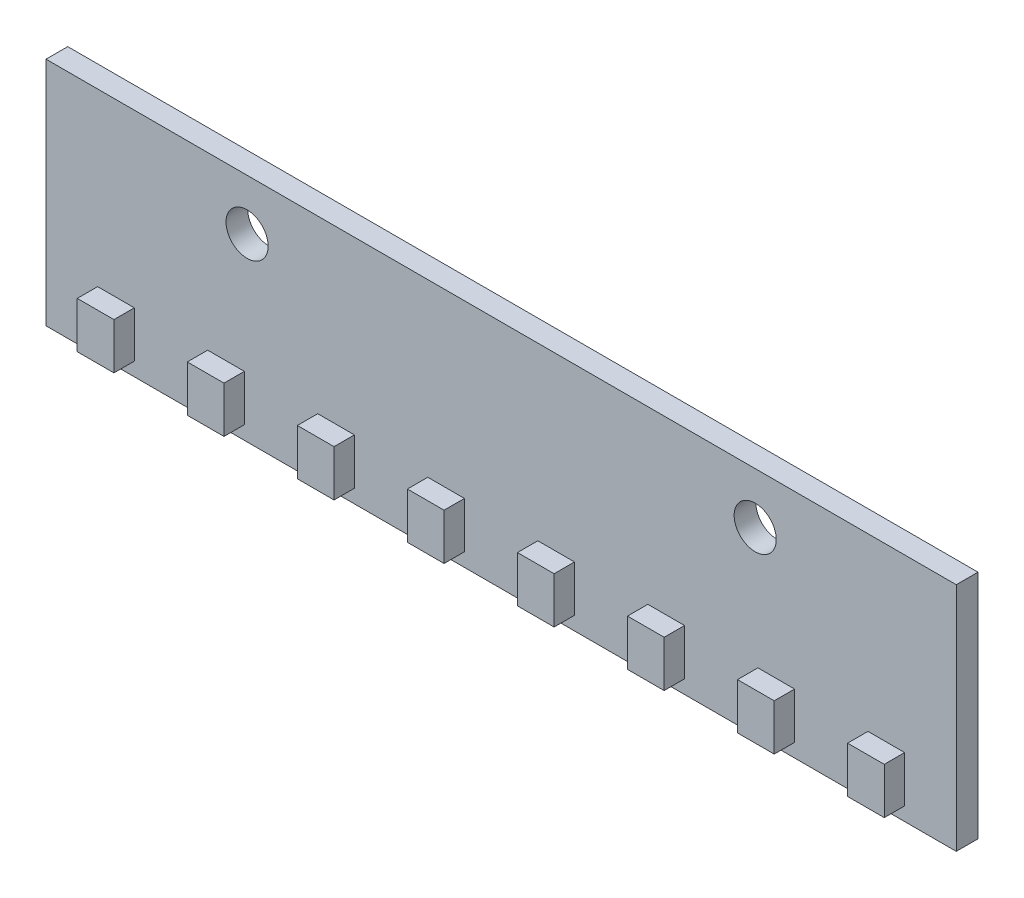
from build123d import *

# Parameters (mm, degrees)
ESBO_O1_W                = 67
ESBO_O1_H                = 17
RESSALTO_EXTRUS_O1_DEPTH = 1.6
ESBO_O2_R                = 1.55
CORTE_EXTRUS_O1_DEPTH    = 70.141593849
ESBO_O3_W                = 2.7
ESBO_O3_H                = 3.4
RESSALTO_EXTRUS_O2_DEPTH = 1.5


with BuildPart() as part:
    # Esboço1 → Ressalto-extrusão1 (new body)
    with BuildSketch(Plane.XY):
        with Locations((33.5, 8.5)):
            Rectangle(ESBO_O1_W, ESBO_O1_H)
    extrude(amount=RESSALTO_EXTRUS_O1_DEPTH)

    # Esboço2 → Corte-extrusão1 (cut, through all)
    with BuildSketch(Plane.XY.offset(1.6)):
        with Locations((14.8, 13.25)):
            Circle(ESBO_O2_R)
        with Locations((52.2, 13.25)):
            Circle(ESBO_O2_R)
    extrude(amount=-CORTE_EXTRUS_O1_DEPTH, mode=Mode.SUBTRACT)

    # Esboço3 → Ressalto-extrusão2 (add)
    with BuildSketch(Plane.XY.offset(1.6)):
        with Locations((5.15, 2.7)):
            Rectangle(ESBO_O3_W, ESBO_O3_H)
        with Locations((13.25, 2.7)):
            Rectangle(ESBO_O3_W, ESBO_O3_H)
        with Locations((21.35, 2.7)):
            Rectangle(ESBO_O3_W, ESBO_O3_H)
        with Locations((29.45, 2.7)):
            Rectangle(ESBO_O3_W, ESBO_O3_H)
        with Locations((37.55, 2.7)):
            Rectangle(ESBO_O3_W, ESBO_O3_H)
        with Locations((45.65, 2.7)):
            Rectangle(ESBO_O3_W, ESBO_O3_H)
        with Locations((53.75, 2.7)):
            Rectangle(ESBO_O3_W, ESBO_O3_H)
        with Locations((61.85, 2.7)):
            Rectangle(ESBO_O3_W, ESBO_O3_H)
    extrude(amount=RESSALTO_EXTRUS_O2_DEPTH)


solid = part.part
